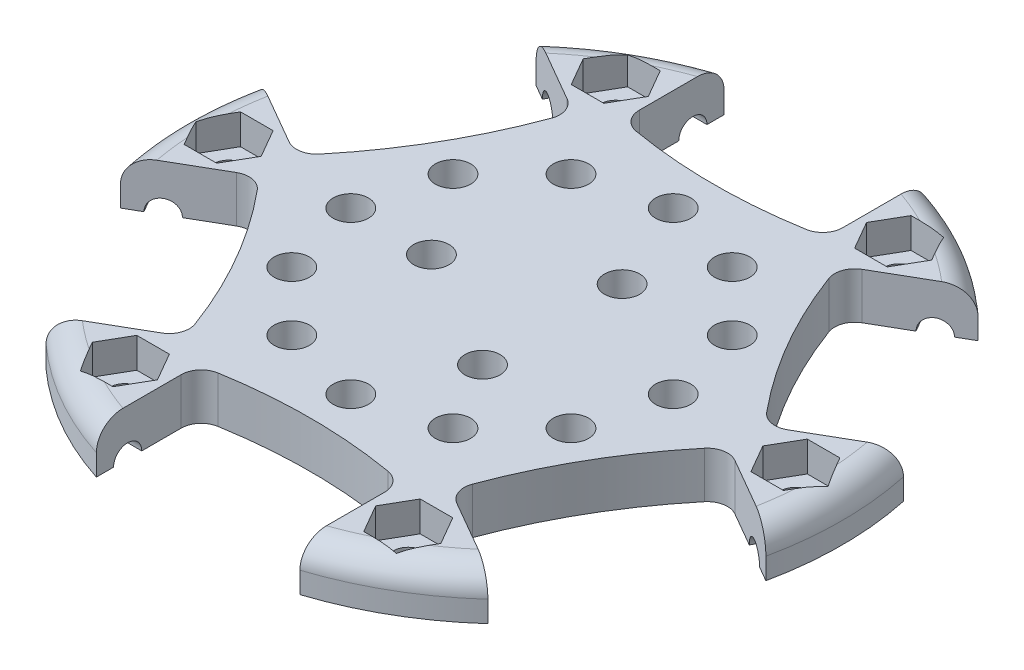
from build123d import *

# Parameters (mm, degrees)
CORTE_EXTRUS_O2_DEPTH  = 10
ESBO_O5_W              = 25.2
ESBO_O5_H              = 1.4
ESBO_O10_W             = 25.2
ESBO_O10_H             = 1.4
ESBO_O12_R             = 1.75
ESBO_O12_R_2           = 1.3
CORTE_EXTRUS_O9_DEPTH  = 46.434293366
ESBO_O17_R             = 1.75
CORTE_EXTRUS_O10_DEPTH = 46.434293366
CORTE_EXTRUS_O12_DEPTH = 3
ESBO_O19_R             = 1.5
CORTE_EXTRUS_O13_DEPTH = 46.434293366
CORTE_EXTRUS_O14_DEPTH = 3


with BuildPart() as part:
    # Esboço1 → Revolução3 (revolve)
    with BuildSketch(Plane.XY, mode=Mode.PRIVATE) as revolu_o3_sk:
        with BuildLine():
            Line((-32.75, 2.1), (-32.75, 0))
            Line((-32.75, 0), (0, 0))
            Line((0, 0), (0, 4.6))
            Line((0, 4.6), (-6.07, 4.6))
            Line((-6.07, 4.6), (-30.25, 4.6))
            ThreePointArc((-30.25, 4.6), (-32.017766953, 3.867766953), (-32.75, 2.1))
        make_face()
    revolve(revolu_o3_sk.sketch.rotate(Axis((0, 0, 0), (0, 1, 0)), 270), axis=Axis((0, 0, 0), (0, 1, 0)))

    # Esboço3 → Corte-extrusão2 (cut)
    with BuildSketch(Plane.XZ):
        with BuildLine():
            Line((-10.1, 71.55), (10.1, 71.55))
            Line((10.1, 71.55), (10.1, 22.738373522))
            ThreePointArc((10.1, 22.738373522), (9.628888485, 21.448993826), (8.4375, 20.767055752))
            ThreePointArc((8.4375, 20.767055752), (0, 20.05), (-8.4375, 20.767055752))
            ThreePointArc((-8.4375, 20.767055752), (-9.628888485, 21.448993826), (-10.1, 22.738373522))
            Line((-10.1, 22.738373522), (-10.1, 71.55))
        make_face()
        with BuildLine():
            Line((10.1, -71.55), (-10.1, -71.55))
            Line((-10.1, -71.55), (-10.1, -22.738373522))
            ThreePointArc((-10.1, -22.738373522), (-9.628888485, -21.448993826), (-8.4375, -20.767055752))
            ThreePointArc((-8.4375, -20.767055752), (0, -20.05), (8.4375, -20.767055752))
            ThreePointArc((8.4375, -20.767055752), (9.628888485, -21.448993826), (10.1, -22.738373522))
            Line((10.1, -22.738373522), (10.1, -71.55))
        make_face()
        with BuildLine():
            Line((56.914117641, 44.521856578), (67.014117641, 27.028143422))
            Line((67.014117641, 27.028143422), (24.742009111, 2.622330183))
            ThreePointArc((24.742009111, 2.622330183), (23.389817782, 2.385634875), (22.203547843, 3.076438532))
            ThreePointArc((22.203547843, 3.076438532), (17.363809346, 10.025), (13.766047843, 17.69061722))
            ThreePointArc((13.766047843, 17.69061722), (13.760929296, 19.063358951), (14.642009111, 20.116043339))
            Line((14.642009111, 20.116043339), (56.914117641, 44.521856578))
        make_face()
        with BuildLine():
            Line((-56.914117641, -44.521856578), (-67.014117641, -27.028143422))
            Line((-67.014117641, -27.028143422), (-24.742009111, -2.622330183))
            ThreePointArc((-24.742009111, -2.622330183), (-23.389817782, -2.385634875), (-22.203547843, -3.076438532))
            ThreePointArc((-22.203547843, -3.076438532), (-17.363809346, -10.025), (-13.766047843, -17.69061722))
            ThreePointArc((-13.766047843, -17.69061722), (-13.760929296, -19.063358951), (-14.642009111, -20.116043339))
            Line((-14.642009111, -20.116043339), (-56.914117641, -44.521856578))
        make_face()
        with BuildLine():
            Line((-67.014117641, 27.028143422), (-56.914117641, 44.521856578))
            Line((-56.914117641, 44.521856578), (-14.642009111, 20.116043339))
            ThreePointArc((-14.642009111, 20.116043339), (-13.760929296, 19.063358951), (-13.766047843, 17.69061722))
            ThreePointArc((-13.766047843, 17.69061722), (-17.363809346, 10.025), (-22.203547843, 3.076438532))
            ThreePointArc((-22.203547843, 3.076438532), (-23.389817782, 2.385634875), (-24.742009111, 2.622330183))
            Line((-24.742009111, 2.622330183), (-67.014117641, 27.028143422))
        make_face()
        with BuildLine():
            Line((67.014117641, -27.028143422), (56.914117641, -44.521856578))
            Line((56.914117641, -44.521856578), (14.642009111, -20.116043339))
            ThreePointArc((14.642009111, -20.116043339), (13.760929296, -19.063358951), (13.766047843, -17.69061722))
            ThreePointArc((13.766047843, -17.69061722), (17.363809346, -10.025), (22.203547843, -3.076438532))
            ThreePointArc((22.203547843, -3.076438532), (23.389817782, -2.385634875), (24.742009111, -2.622330183))
            Line((24.742009111, -2.622330183), (67.014117641, -27.028143422))
        make_face()
    extrude(amount=-CORTE_EXTRUS_O2_DEPTH, mode=Mode.SUBTRACT)

    # Esboço5 → Corte-Revolução3 (revolve, cut)
    with BuildSketch(Plane.XZ):
        with Locations((0, 27.35)):
            Rectangle(ESBO_O5_W, ESBO_O5_H)
    revolve(axis=Axis((-12.6, 0, 28.05), (1, 0, 0)), mode=Mode.SUBTRACT)

    # Esboço6 → Corte-Revolução4 (revolve, cut)
    with BuildSketch(Plane.XZ):
        Polygon((-29.379577011, 2.413079912), (-16.779577011, 24.236920088), (-17.992012576, 24.936920088), (-30.592012576, 3.113079912), align=None)
    revolve(axis=Axis((-30.592012576, 0, 3.113079912), (0.49999999999999983, 0, 0.8660254037844388)), mode=Mode.SUBTRACT)

    # Esboço7 → Corte-Revolução5 (revolve, cut)
    with BuildSketch(Plane.XZ):
        Polygon((-16.779577011, -24.236920088), (-29.379577011, -2.413079912), (-30.592012576, -3.113079912), (-17.992012576, -24.936920088), align=None)
    revolve(axis=Axis((-17.992012576, 0, -24.936920088), (-0.4999999999999998, 0, 0.8660254037844388)), mode=Mode.SUBTRACT)

    # Esboço8 → Corte-Revolução6 (revolve, cut)
    with BuildSketch(Plane.XZ):
        Polygon((16.779577011, 24.236920088), (29.379577011, 2.413079912), (30.592012576, 3.113079912), (17.992012576, 24.936920088), align=None)
    revolve(axis=Axis((17.992012576, 0, 24.936920088), (0.5000000000000001, 0, -0.8660254037844386)), mode=Mode.SUBTRACT)

    # Esboço10 → Corte-Revolução7 (revolve, cut)
    with BuildSketch(Plane.XZ):
        with Locations((0, -27.35)):
            Rectangle(ESBO_O10_W, ESBO_O10_H)
    revolve(axis=Axis((12.6, 0, -28.05), (-1, 0, 0)), mode=Mode.SUBTRACT)

    # Esboço11 → Corte-Revolução8 (revolve, cut)
    with BuildSketch(Plane.XZ):
        Polygon((29.379577011, -2.413079912), (16.779577011, -24.236920088), (17.992012576, -24.936920088), (30.592012576, -3.113079912), align=None)
    revolve(axis=Axis((30.592012576, 0, -3.113079912), (-0.49999999999999994, 0, -0.8660254037844387)), mode=Mode.SUBTRACT)

    # Esboço12 → Corte-extrusão9 (cut, through all)
    with BuildSketch(Plane.XZ):
        with Locations(Location((0, 16, 0), (0, 0, 270))):
            Circle(ESBO_O12_R)
        with Locations(Location((-8, 13.856406461, 0), (0, 0, 270))):
            Circle(ESBO_O12_R)
        with Locations(Location((-13.856406461, 8, 0), (0, 0, 270))):
            Circle(ESBO_O12_R)
        with Locations(Location((-16, 0, 0), (0, 0, 270))):
            Circle(ESBO_O12_R)
        with Locations(Location((-13.856406461, -8, 0), (0, 0, 270))):
            Circle(ESBO_O12_R)
        with Locations(Location((-8, -13.856406461, 0), (0, 0, 270))):
            Circle(ESBO_O12_R)
        with Locations(Location((0, -16, 0), (0, 0, 270))):
            Circle(ESBO_O12_R)
        with Locations(Location((8, -13.856406461, 0), (0, 0, 270))):
            Circle(ESBO_O12_R)
        with Locations(Location((13.856406461, -8, 0), (0, 0, 270))):
            Circle(ESBO_O12_R)
        with Locations(Location((16, 0, 0), (0, 0, 270))):
            Circle(ESBO_O12_R)
        with Locations(Location((13.856406461, 8, 0), (0, 0, 270))):
            Circle(ESBO_O12_R)
        with Locations(Location((8, 13.856406461, 0), (0, 0, 270))):
            Circle(ESBO_O12_R)
        with Locations(Location((28.129577011, 0, 0), (0, 0, 270))):
            Circle(ESBO_O12_R_2)
        with Locations(Location((14.064788505, 24.360928289, 0), (0, 0, 270))):
            Circle(ESBO_O12_R_2)
        with Locations(Location((-14.064788505, 24.360928289, 0), (0, 0, 270))):
            Circle(ESBO_O12_R_2)
        with Locations(Location((-28.129577011, 0, 0), (0, 0, 270))):
            Circle(ESBO_O12_R_2)
        with Locations(Location((14.064788505, -24.360928289, 0), (0, 0, 270))):
            Circle(ESBO_O12_R_2)
        with Locations(Location((-14.064788505, -24.360928289, 0), (0, 0, 270))):
            Circle(ESBO_O12_R_2)
    extrude(amount=-CORTE_EXTRUS_O9_DEPTH, mode=Mode.SUBTRACT)

    # Esboço17 → Corte-extrusão10 (cut, through all)
    with BuildSketch(Plane.XZ):
        with Locations(Location((4, 6.92820323, 0), (0, 0, 270))):
            Circle(ESBO_O17_R)
        with Locations(Location((-8, 0, 0), (0, 0, 270))):
            Circle(ESBO_O17_R)
        with Locations(Location((4, -6.92820323, 0), (0, 0, 270))):
            Circle(ESBO_O17_R)
    extrude(amount=-CORTE_EXTRUS_O10_DEPTH, mode=Mode.SUBTRACT)

    # Esboço18 → Corte-extrusão12 (cut)
    with BuildSketch(Plane(origin=(0, 4.6, 0), x_dir=(1, 0, 0), z_dir=(0, 1, 0))):
        Polygon((-31.016328357, 0), (-29.572952684, -2.5), (-26.686201338, -2.5), (-25.242825665, 0), (-26.686201338, 2.5), (-29.572952684, 2.5), align=None)
        Polygon((-15.508164178, 26.860928289), (-16.951539851, 24.360928289), (-15.508164178, 21.860928289), (-12.621412832, 21.860928289), (-11.178037159, 24.360928289), (-12.621412832, 26.860928289), align=None)
        Polygon((15.508164178, 26.860928289), (12.621412832, 26.860928289), (11.178037159, 24.360928289), (12.621412832, 21.860928289), (15.508164178, 21.860928289), (16.951539851, 24.360928289), align=None)
        Polygon((31.016328357, 0), (29.572952684, 2.5), (26.686201338, 2.5), (25.242825665, 0), (26.686201338, -2.5), (29.572952684, -2.5), align=None)
        Polygon((15.508164178, -26.860928289), (16.951539851, -24.360928289), (15.508164178, -21.860928289), (12.621412832, -21.860928289), (11.178037159, -24.360928289), (12.621412832, -26.860928289), align=None)
        Polygon((-15.508164178, -26.860928289), (-12.621412832, -26.860928289), (-11.178037159, -24.360928289), (-12.621412832, -21.860928289), (-15.508164178, -21.860928289), (-16.951539851, -24.360928289), align=None)
    extrude(amount=-CORTE_EXTRUS_O12_DEPTH, mode=Mode.SUBTRACT)

    # Esboço19 → Corte-extrusão13 (cut, through all)
    with BuildSketch(Plane(origin=(0, 4.6, 0), x_dir=(1, 0, 0), z_dir=(0, 1, 0))):
        with Locations(Location((-14.064788505, 24.360928289, 0), (0, 0, 270))):
            Circle(ESBO_O19_R)
        with Locations(Location((14.064788505, 24.360928289, 0), (0, 0, 270))):
            Circle(ESBO_O19_R)
        with Locations(Location((14.064788505, -24.360928289, 0), (0, 0, 270))):
            Circle(ESBO_O19_R)
        with Locations(Location((-14.064788505, -24.360928289, 0), (0, 0, 270))):
            Circle(ESBO_O19_R)
        with Locations(Location((-28.129577011, 0, 0), (0, 0, 270))):
            Circle(ESBO_O19_R)
        with Locations(Location((28.129577011, 0, 0), (0, 0, 270))):
            Circle(ESBO_O19_R)
    extrude(amount=-CORTE_EXTRUS_O13_DEPTH, mode=Mode.SUBTRACT)

    # Esboço20 → Corte-extrusão14 (cut)
    with BuildSketch(Plane(origin=(0, 4.6, 0), x_dir=(1, 0, 0), z_dir=(0, 1, 0))):
        Polygon((26.512996257, -2.8), (29.746157765, -2.8), (31.362738518, 0), (29.746157765, 2.8), (26.512996257, 2.8), (24.896415503, 0), align=None)
        Polygon((-29.746157765, 2.8), (-31.362738518, 0), (-29.746157765, -2.8), (-26.512996257, -2.8), (-24.896415503, 0), (-26.512996257, 2.8), align=None)
        Polygon((15.681369259, 27.160928289), (12.448207752, 27.160928289), (10.831626998, 24.360928289), (12.448207752, 21.560928289), (15.681369259, 21.560928289), (17.297950013, 24.360928289), align=None)
        Polygon((-10.831626998, 24.360928289), (-12.448207752, 27.160928289), (-15.681369259, 27.160928289), (-17.297950013, 24.360928289), (-15.681369259, 21.560928289), (-12.448207752, 21.560928289), align=None)
        Polygon((-15.681369259, -27.160928289), (-12.448207752, -27.160928289), (-10.831626998, -24.360928289), (-12.448207752, -21.560928289), (-15.681369259, -21.560928289), (-17.297950013, -24.360928289), align=None)
        Polygon((17.297950013, -24.360928289), (15.681369259, -21.560928289), (12.448207752, -21.560928289), (10.831626998, -24.360928289), (12.448207752, -27.160928289), (15.681369259, -27.160928289), align=None)
    extrude(amount=-CORTE_EXTRUS_O14_DEPTH, mode=Mode.SUBTRACT)


solid = part.part
